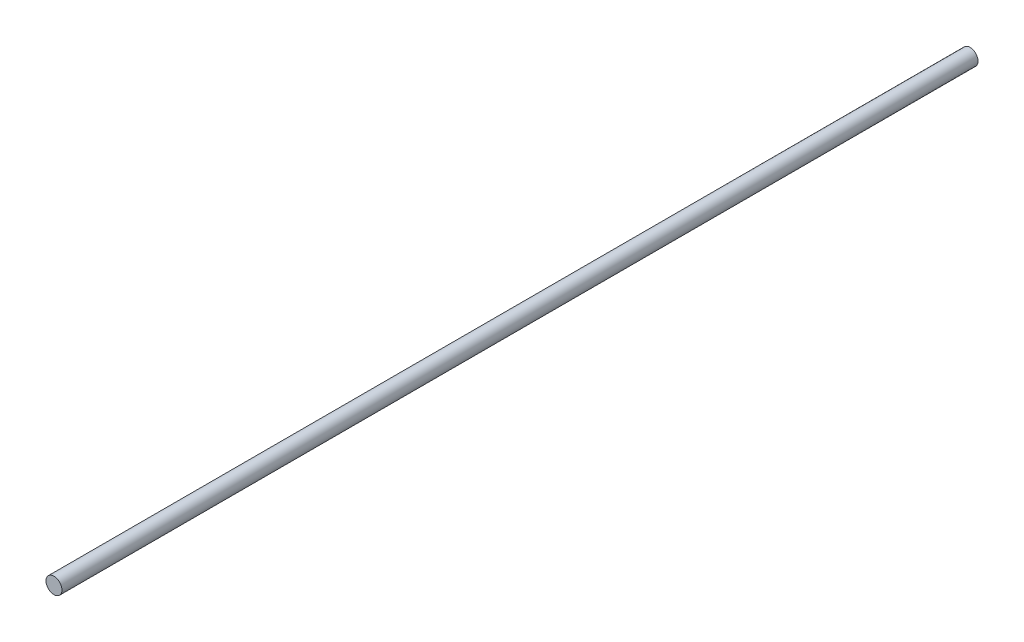
from build123d import *

# Parameters (mm, degrees)
SKETCH_1_R      = 1.5
EXTRUDE_1_DEPTH = 172


with BuildPart() as part:
    # 草图1 → 凸台-拉伸1 (new body)
    with BuildSketch(Plane.XY):
        Circle(SKETCH_1_R)
    extrude(amount=EXTRUDE_1_DEPTH)


solid = part.part
